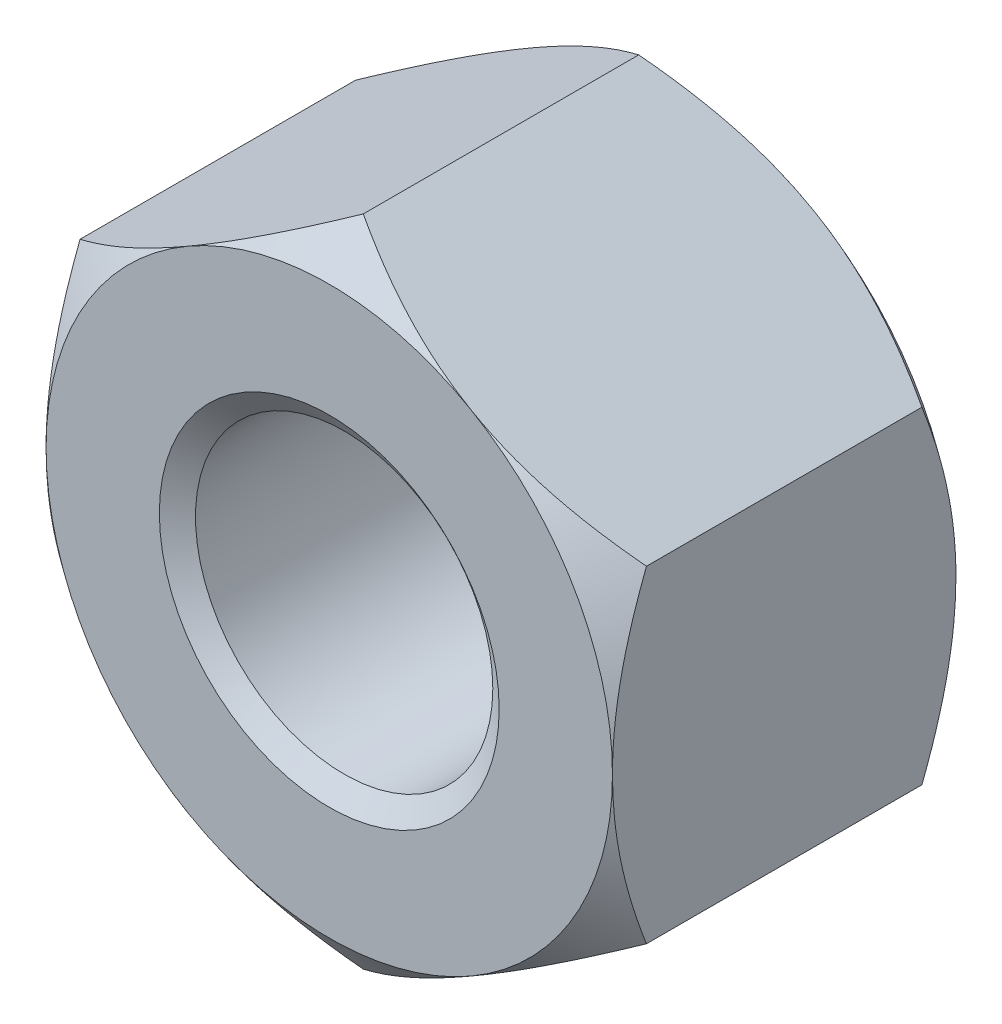
from build123d import *

# Parameters (mm, degrees)
BASENUT_START = -19.2532
BASENUTSKE_R  = 8.33374
BASENUT_DEPTH = 19.2532


with BuildPart() as part:
    # BaseNutSke → BaseNut (new body)
    with BuildSketch(Plane.XY.offset(BASENUT_START)):
        Polygon((15.875, 9.165435523), (15.875, -9.165435523), (0, -18.330871047), (-15.875, -9.165435523), (-15.875, 9.165435523), (0, 18.330871047), align=None)
        Circle(BASENUTSKE_R, mode=Mode.SUBTRACT)
    extrude(amount=BASENUT_DEPTH)

    # Sketch3 → Double-Chamfer (revolve, cut)
    with BuildSketch(Plane(origin=(0, 0, 0), x_dir=(0, 0, -1), z_dir=(1, 0, 0))):
        Polygon((19.2532, 15.875), (17.3482, 18.330871047), (17.3482, 31.030871047), (31.9532, 31.030871047), (31.9532, 15.875), align=None)
        Polygon((1.905, 31.030871047), (-12.7, 31.030871047), (-12.7, 15.875), (0, 15.875), (1.905, 18.330871047), align=None)
    revolve(axis=Axis((0, 0, 0), (0, 0, -1)), mode=Mode.SUBTRACT)

    # Sketch5 → EndChamfer (revolve, cut)
    with BuildSketch(Plane(origin=(0, 0, 0), x_dir=(0, 0, -1), z_dir=(1, 0, 0)), mode=Mode.PRIVATE) as endchamfer_sk:
        Polygon((19.2278, 9.525), (18.310257845, 8.214614), (19.2786, 8.214614), (19.2786, 9.525), align=None)
        Polygon((-0.0508, 9.525), (0, 9.525), (0.917542155, 8.214614), (-0.0508, 8.214614), align=None)
    revolve(endchamfer_sk.sketch.rotate(Axis((0, 0, -25.037505729), (0, 0, -1)), 90), axis=Axis((0, 0, -25.037505729), (0, 0, -1)), mode=Mode.SUBTRACT)


solid = part.part
